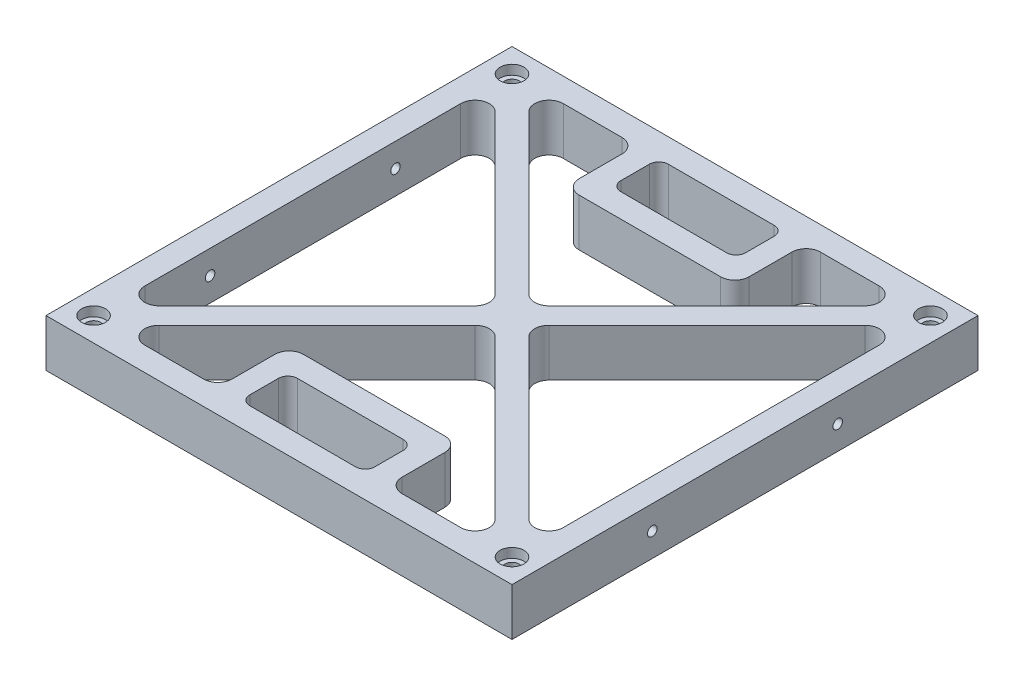
from build123d import *

# Parameters (mm, degrees)
SKETCH1_W           = 106
SKETCH1_H           = 106
BOSS_EXTRUDE1_DEPTH = 10
CUT_EXTRUDE9_DEPTH  = 1.5
SKETCH18_W          = 106
SKETCH18_H          = 106
SKETCH18_W_2        = 100
SKETCH18_H_2        = 100
CUT_EXTRUDE14_DEPTH = 10
SKETCH20_R          = 1
CUT_EXTRUDE15_DEPTH = 8
CUT_EXTRUDE16_START = -8
SKETCH21_R          = 1
CUT_EXTRUDE16_DEPTH = 8
SKETCH23_W          = 100
SKETCH23_H          = 100
SKETCH23_W_2        = 98
SKETCH23_H_2        = 98
CUT_EXTRUDE17_DEPTH = 10
SKETCH17_W          = 26.25282414
SKETCH17_H          = 10
CUT_EXTRUDE19_DEPTH = 10
FILLET2_R           = 3
FILLET3_R           = 3
FILLET4_R           = 2
SKETCH26_R          = 1.5
CUT_EXTRUDE20_DEPTH = 10
SKETCH27_R          = 2.5
CUT_EXTRUDE21_DEPTH = 2


with BuildPart() as part:
    # Sketch1 → Boss-Extrude1 (new body)
    with BuildSketch(Plane(origin=(0, 0, 0), x_dir=(1, 0, 0), z_dir=(0, 1, 0))):
        Rectangle(SKETCH1_W, SKETCH1_H)
    extrude(amount=BOSS_EXTRUDE1_DEPTH)

    # Sketch12 → Cut-Extrude9 (cut)
    with BuildSketch(Plane(origin=(53, 0, 0), x_dir=(0, 0, -1), z_dir=(1, 0, 0))):
        with BuildLine():
            ThreePointArc((-17.75, 5), (-18.262563133, 6.237436867), (-19.5, 6.75))
            Line((-19.5, 6.75), (-19.5, 3.25))
            ThreePointArc((-19.5, 3.25), (-18.262563133, 3.762563133), (-17.75, 5))
        make_face()
        with BuildLine():
            Line((-19.5, 3.25), (-19.5, 6.75))
            ThreePointArc((-19.5, 6.75), (-21.25, 5), (-19.5, 3.25))
        make_face()
        with BuildLine():
            ThreePointArc((21.25, 5), (20.737436867, 6.237436867), (19.5, 6.75))
            Line((19.5, 6.75), (19.5, 3.25))
            ThreePointArc((19.5, 3.25), (20.737436867, 3.762563133), (21.25, 5))
        make_face()
        with BuildLine():
            Line((19.5, 3.25), (19.5, 6.75))
            ThreePointArc((19.5, 6.75), (17.75, 5), (19.5, 3.25))
        make_face()
    extrude(amount=-CUT_EXTRUDE9_DEPTH, mode=Mode.SUBTRACT)

    # Sketch18 → Cut-Extrude14 (cut)
    with BuildSketch(Plane.XZ):
        Rectangle(SKETCH18_W, SKETCH18_H)
        Rectangle(SKETCH18_W_2, SKETCH18_H_2, mode=Mode.SUBTRACT)
    extrude(amount=-CUT_EXTRUDE14_DEPTH, mode=Mode.SUBTRACT)

    # Sketch20 → Cut-Extrude15 (cut)
    with BuildSketch(Plane(origin=(50, 0, 0), x_dir=(0, 0, -1), z_dir=(1, 0, 0))):
        with Locations((19.5, 5)):
            Circle(SKETCH20_R)
        with Locations((-19.5, 5)):
            Circle(SKETCH20_R)
    extrude(amount=-CUT_EXTRUDE15_DEPTH, mode=Mode.SUBTRACT)

    # Sketch21 → Cut-Extrude16 (cut)
    with BuildSketch(Plane.ZY.offset(50).offset(CUT_EXTRUDE16_START)):
        with Locations(Location((19.5, 5, 0), (0, 0, 180))):
            Circle(SKETCH21_R)
        with Locations(Location((-19.5, 5, 0), (0, 0, 180))):
            Circle(SKETCH21_R)
    extrude(amount=CUT_EXTRUDE16_DEPTH, mode=Mode.SUBTRACT)

    # Sketch23 → Cut-Extrude17 (cut)
    with BuildSketch(Plane.XZ):
        Rectangle(SKETCH23_W, SKETCH23_H)
        Rectangle(SKETCH23_W_2, SKETCH23_H_2, mode=Mode.SUBTRACT)
    extrude(amount=-CUT_EXTRUDE17_DEPTH, mode=Mode.SUBTRACT)

    # Sketch17 → Cut-Extrude19 (cut)
    with BuildSketch(Plane.XZ):
        Polygon((-40.464466094, 44), (0, 3.535533906), (40.464466094, 44), (17.869219367, 44), (17.869219367, 29), (-17.869219367, 29), (-17.869219367, 44), align=None)
        with Locations((0, 39)):
            Rectangle(SKETCH17_W, SKETCH17_H)
        Polygon((44, -40.464466094), (44, 40.464466094), (3.535533906, 0), align=None)
        Polygon((-3.535533906, 0), (-44, 40.464466094), (-44, -40.464466094), align=None)
        Polygon((17.869219367, -44), (40.464466094, -44), (0, -3.535533906), (-40.464466094, -44), (-17.869219367, -44), (-17.869219367, -29), (17.869219367, -29), align=None)
        with Locations((0, -39)):
            Rectangle(SKETCH17_W, SKETCH17_H)
    extrude(amount=-CUT_EXTRUDE19_DEPTH, mode=Mode.SUBTRACT)

    # Fillet2
    fillet2_edges = [part.edges().sort_by_distance(p)[0] for p in [
        (40.464466094, 5, 44),
        (0, 5, 3.535533906),
        (-40.464466094, 5, 44),
        (44, 5, 40.464466094),
        (3.535533906, 5, 0),
        (44, 5, -40.464466094),
        (-44, 5, -40.464466094),
        (-44, 5, 40.464466094),
        (-3.535533906, 5, 0),
        (-40.464466094, 5, -44),
        (0, 5, -3.535533906),
        (40.464466094, 5, -44),
    ]]
    fillet(fillet2_edges, radius=FILLET2_R)

    # Fillet3
    fillet3_edges = [part.edges().sort_by_distance(p)[0] for p in [
        (17.869219367, 5, 29),
        (17.869219367, 5, 44),
        (-17.869219367, 5, 44),
        (-17.869219367, 5, 29),
        (17.869219367, 5, -44),
        (17.869219367, 5, -29),
        (-17.869219367, 5, -29),
        (-17.869219367, 5, -44),
    ]]
    fillet(fillet3_edges, radius=FILLET3_R)

    # Fillet4
    fillet4_edges = [part.edges().sort_by_distance(p)[0] for p in [
        (13.12641207, 5, 34),
        (-13.12641207, 5, 34),
        (-13.12641207, 5, 44),
        (13.12641207, 5, 44),
        (13.12641207, 5, -44),
        (-13.12641207, 5, -44),
        (-13.12641207, 5, -34),
        (13.12641207, 5, -34),
    ]]
    fillet(fillet4_edges, radius=FILLET4_R)

    # Sketch26 → Cut-Extrude20 (cut)
    with BuildSketch(Plane(origin=(0, 10, 0), x_dir=(1, 0, 0), z_dir=(0, 1, 0))):
        with Locations(Location((44, -44, 0), (0, 0, 270))):
            Circle(SKETCH26_R)
        with Locations(Location((-44, -44, 0), (0, 0, 270))):
            Circle(SKETCH26_R)
        with Locations(Location((44, 44, 0), (0, 0, 270))):
            Circle(SKETCH26_R)
        with Locations(Location((-44, 44, 0), (0, 0, 270))):
            Circle(SKETCH26_R)
    extrude(amount=-CUT_EXTRUDE20_DEPTH, mode=Mode.SUBTRACT)

    # Sketch27 → Cut-Extrude21 (cut)
    with BuildSketch(Plane(origin=(0, 10, 0), x_dir=(1, 0, 0), z_dir=(0, 1, 0))):
        with Locations(Location((44, -44, 0), (0, 0, 270))):
            Circle(SKETCH27_R)
        with Locations(Location((-44, -44, 0), (0, 0, 270))):
            Circle(SKETCH27_R)
        with Locations(Location((-44, 44, 0), (0, 0, 270))):
            Circle(SKETCH27_R)
        with Locations(Location((44, 44, 0), (0, 0, 270))):
            Circle(SKETCH27_R)
    extrude(amount=-CUT_EXTRUDE21_DEPTH, mode=Mode.SUBTRACT)


solid = part.part
